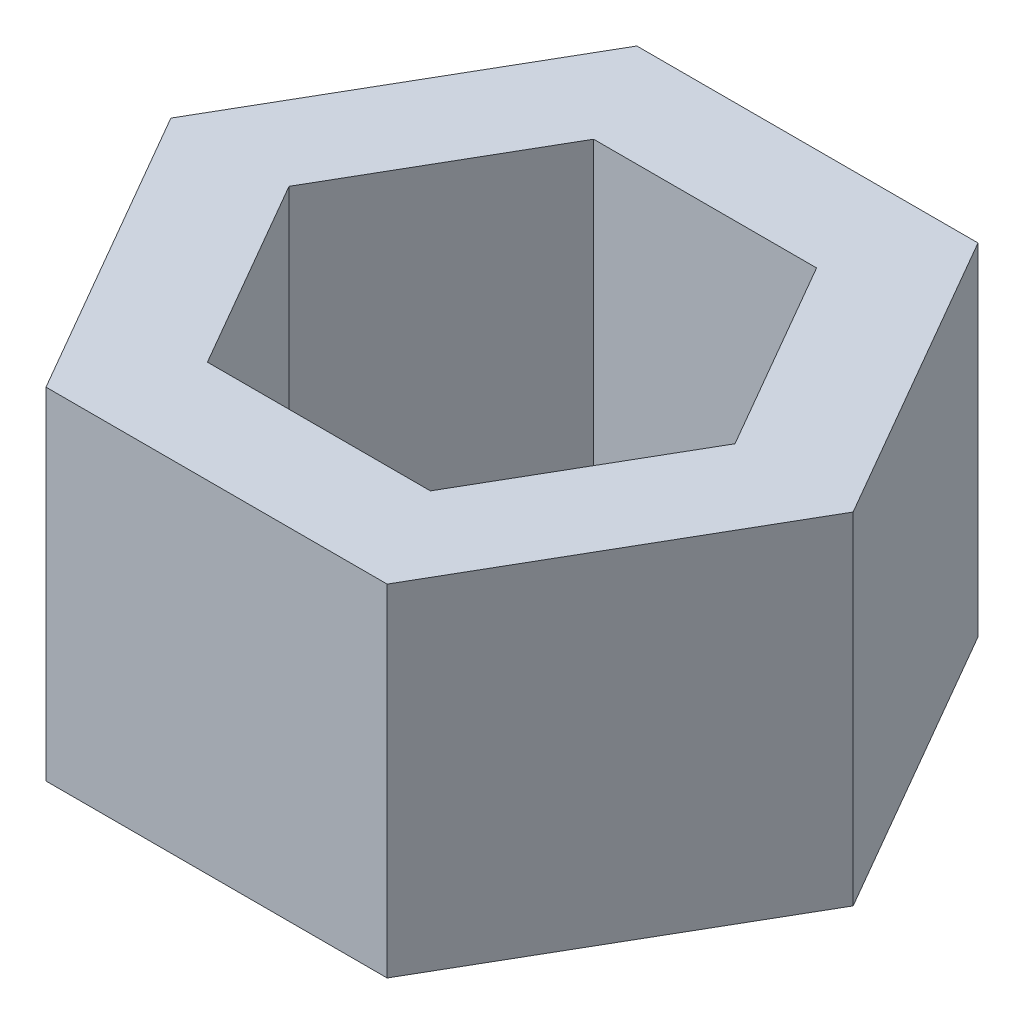
from build123d import *

# Parameters (mm, degrees)
BOSS_EXTRUDE1_DEPTH = 50
CUT_EXTRUDE1_DEPTH  = 83.915619759


with BuildPart() as part:
    # Sketch1 → Boss-Extrude1 (new body)
    with BuildSketch(Plane(origin=(0, 0, 0), x_dir=(1, 0, 0), z_dir=(0, 1, 0))):
        Polygon((-25, -43.301270189), (25, -43.301270189), (50, 0), (25, 43.301270189), (-25, 43.301270189), (-50, 0), align=None)
    extrude(amount=BOSS_EXTRUDE1_DEPTH)

    # Sketch2 → Cut-Extrude1 (cut, through all)
    with BuildSketch(Plane(origin=(0, 50, 0), x_dir=(1, 0, 0), z_dir=(0, 1, 0))):
        Polygon((-32.679491924, 0), (-16.339745962, -28.301270189), (16.339745962, -28.301270189), (32.679491924, 0), (16.339745962, 28.301270189), (-16.339745962, 28.301270189), align=None)
    extrude(amount=-CUT_EXTRUDE1_DEPTH, mode=Mode.SUBTRACT)


solid = part.part
